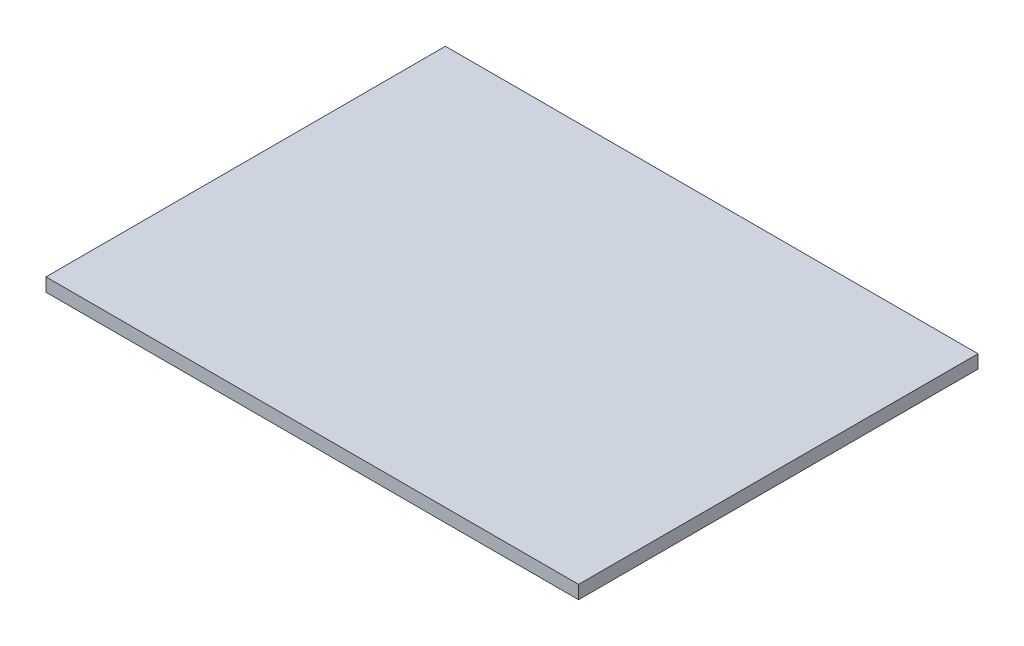
from build123d import *

# Parameters (mm, degrees)
SKETCH1_W                      = 200
SKETCH1_H                      = 150
BOSS_EXTRUDE1_DEPTH            = 5
BOSS_EXTRUDE2_DEPTH            = 10
M3X0_5_TAPPED_HOLE1_AT_2_COUNT = 2
M3X0_5_TAPPED_HOLE1_AT_2_PITCH = 14
CIRPATTERN1_COUNT              = 3


with BuildPart() as part:
    # Sketch1 → Boss-Extrude1 (new body)
    with BuildSketch(Plane(origin=(0, 0, 0), x_dir=(1, 0, 0), z_dir=(0, 1, 0))):
        Rectangle(SKETCH1_W, SKETCH1_H)
    extrude(amount=BOSS_EXTRUDE1_DEPTH)


with BuildPart() as body_2:
    # Sketch2 → Boss-Extrude2 (new body)
    with BuildSketch(Plane(origin=(0, 0, 0), x_dir=(1, 0, 0), z_dir=(0, 1, 0))):
        Polygon((-30, 0), (-15, -25.980762114), (15, -25.980762114), (30, 0), (15, 25.980762114), (-15, 25.980762114), align=None)
    extrude(amount=-BOSS_EXTRUDE2_DEPTH)

    # Sketch4 → M3x0.5 Tapped Hole1 (revolve, cut)
    with BuildSketch(Plane(origin=(-7, -5, 25.980762114), x_dir=(0, -1, 0), z_dir=(1, 0, 0))):
        Polygon((0, 0), (0, 10.751075774), (1.25, 10), (1.25, 0), align=None)
    m3x0_5_tapped_hole1 = revolve(axis=Axis((-7, -5, 32.330762114), (0, 0, -1)), mode=Mode.SUBTRACT)

    # M3x0.5 Tapped Hole1 at 2: M3x0.5 Tapped Hole1 ×2
    with Locations(*[(i * M3X0_5_TAPPED_HOLE1_AT_2_PITCH, 0, 0) for i in range(1, M3X0_5_TAPPED_HOLE1_AT_2_COUNT)]):
        add(m3x0_5_tapped_hole1, mode=Mode.SUBTRACT)

    # CirPattern1: M3x0.5 Tapped Hole1 ×3 about axis
    cirpattern1_axis = Axis((0, 0, 0), (0, 1, 0))
    for i in range(1, CIRPATTERN1_COUNT):
        add(m3x0_5_tapped_hole1.rotate(cirpattern1_axis, i * 360 / CIRPATTERN1_COUNT), mode=Mode.SUBTRACT)

    # CirPattern1 copy 1 sketch → CirPattern1 copy 1 (revolve, cut)
    with BuildSketch(Plane(origin=(19, -5, -19.052558883), x_dir=(0, -1, 0), z_dir=(-0.4999999999999998, 0, -0.8660254037844387))):
        Polygon((0, 0), (0, 10.751075774), (1.25, 10), (1.25, 0), align=None)
    revolve(axis=Axis((24.499261314, -5, -22.227558883), (-0.8660254037844387, 0, 0.4999999999999998)), mode=Mode.SUBTRACT)

    # CirPattern1 copy 2 sketch → CirPattern1 copy 2 (revolve, cut)
    with BuildSketch(Plane(origin=(-26, -5, -6.92820323), x_dir=(0, -1, 0), z_dir=(-0.5000000000000004, 0, 0.8660254037844384))):
        Polygon((0, 0), (0, 10.751075774), (1.25, 10), (1.25, 0), align=None)
    revolve(axis=Axis((-31.499261314, -5, -10.10320323), (0.8660254037844384, 0, 0.5000000000000004)), mode=Mode.SUBTRACT)


solid = Compound([part.part, body_2.part])
